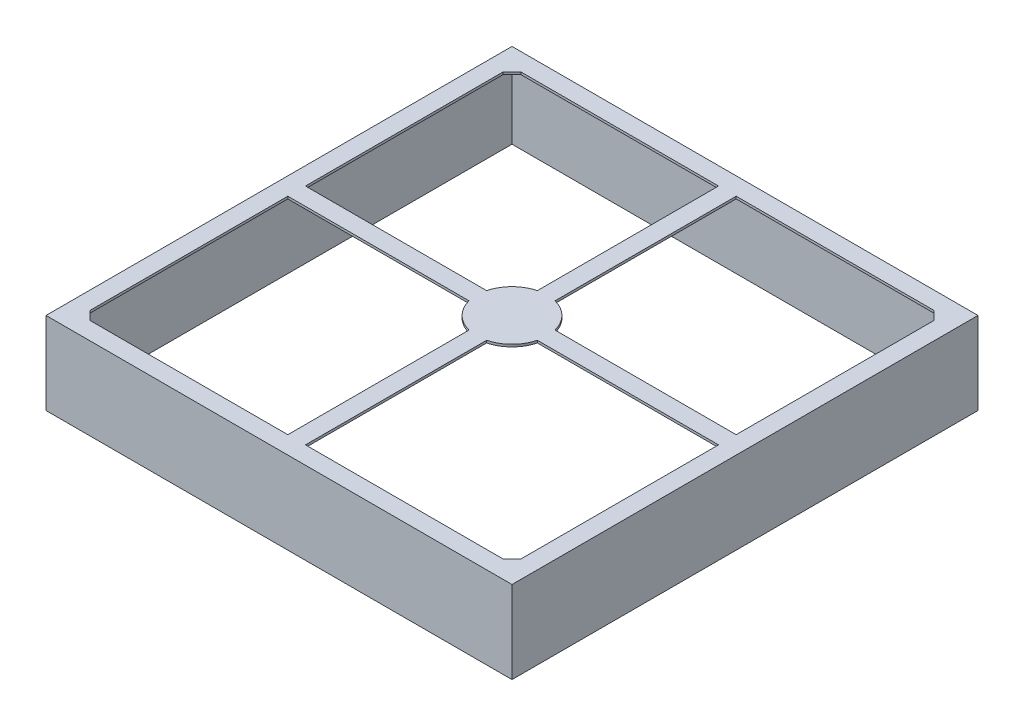
from build123d import *

# Parameters (mm, degrees)
SKETCH1_W           = 39.6
SKETCH1_H           = 39.6
BOSS_EXTRUDE1_DEPTH = 7
SHELL2_T            = -0.2
CUT_EXTRUDE1_DEPTH  = 29.863125264


with BuildPart() as part:
    # Sketch1 → Boss-Extrude1 (new body)
    with BuildSketch(Plane(origin=(0, 0, 0), x_dir=(1, 0, 0), z_dir=(0, 1, 0))):
        Rectangle(SKETCH1_W, SKETCH1_H)
    extrude(amount=BOSS_EXTRUDE1_DEPTH)

    # Shell2
    shell2_openings = [part.faces().sort_by_distance(p)[0] for p in [
        (0, 0, 0),
    ]]
    offset(amount=SHELL2_T, openings=shell2_openings, kind=Kind.INTERSECTION)

    # Sketch2 → Cut-Extrude1 (cut, through all)
    with BuildSketch(Plane(origin=(0, 0, 0), x_dir=(1, 0, 0), z_dir=(0, 1, 0))):
        with BuildLine():
            Line((17.55, -18.3), (0.75, -18.3))
            Line((0.75, -18.3), (0.75, -2.90473751))
            ThreePointArc((0.75, -2.90473751), (2.121320344, -2.121320344), (2.90473751, -0.75))
            Line((2.90473751, -0.75), (18.3, -0.75))
            Line((18.3, -0.75), (18.3, -17.55))
            Line((18.3, -17.55), (17.55, -18.3))
        make_face()
        with BuildLine():
            Line((17.55, 18.3), (0.75, 18.3))
            Line((0.75, 18.3), (0.75, 2.90473751))
            ThreePointArc((0.75, 2.90473751), (2.121320344, 2.121320344), (2.90473751, 0.75))
            Line((2.90473751, 0.75), (18.3, 0.75))
            Line((18.3, 0.75), (18.3, 17.55))
            Line((18.3, 17.55), (17.55, 18.3))
        make_face()
        with BuildLine():
            Line((-18.3, -17.55), (-18.3, -0.75))
            Line((-18.3, -0.75), (-2.90473751, -0.75))
            ThreePointArc((-2.90473751, -0.75), (-2.121320344, -2.121320344), (-0.75, -2.90473751))
            Line((-0.75, -2.90473751), (-0.75, -18.3))
            Line((-0.75, -18.3), (-17.55, -18.3))
            Line((-17.55, -18.3), (-18.3, -17.55))
        make_face()
        with BuildLine():
            Line((-0.75, 18.3), (-0.75, 2.90473751))
            ThreePointArc((-0.75, 2.90473751), (-2.121320344, 2.121320344), (-2.90473751, 0.75))
            Line((-2.90473751, 0.75), (-18.3, 0.75))
            Line((-18.3, 0.75), (-18.3, 17.55))
            Line((-18.3, 17.55), (-17.55, 18.3))
            Line((-17.55, 18.3), (-0.75, 18.3))
        make_face()
    extrude(amount=CUT_EXTRUDE1_DEPTH, mode=Mode.SUBTRACT)


solid = part.part
